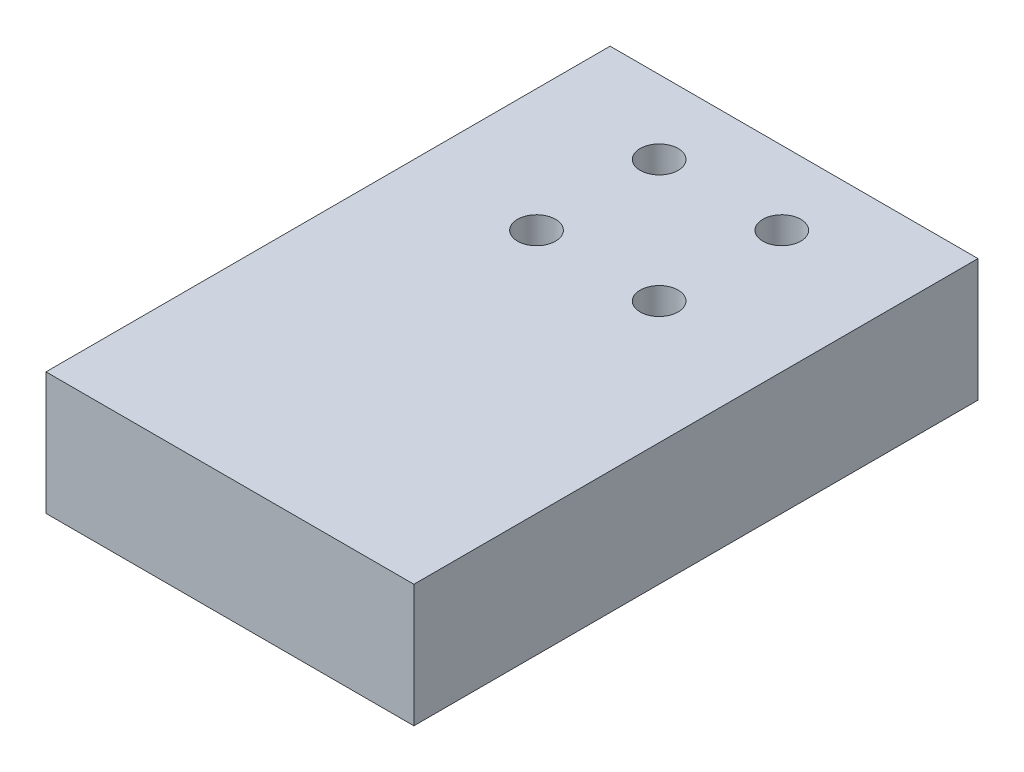
from build123d import *

# Parameters (mm, degrees)
SKETCH_1_W          = 30
SKETCH_1_H          = 30
EXTRUDE_1_DEPTH     = 10
SKETCH_4_R          = 1.55
CUT_EXTRUDE_1_DEPTH = 30
SKETCH_5_R          = 3.5
SKETCH_5_R_2        = 1.55
CUT_EXTRUDE_2_DEPTH = 3
SKETCH_6_W          = 30
SKETCH_6_H          = 10
EXTRUDE_2_DEPTH     = 16


with BuildPart() as part:
    # 草图1 → 凸台-拉伸1 (new body)
    with BuildSketch(Plane(origin=(0, 0, 0), x_dir=(1, 0, 0), z_dir=(0, 1, 0))):
        Rectangle(SKETCH_1_W, SKETCH_1_H)
    extrude(amount=EXTRUDE_1_DEPTH)

    # 草图4 → 切除-拉伸1 (cut)
    with BuildSketch(Plane.XZ):
        with Locations(Location((5, 1, 0), (0, 0, 270))):
            Circle(SKETCH_4_R)
        with Locations(Location((5, -9, 0), (0, 0, 270))):
            Circle(SKETCH_4_R)
        with Locations(Location((-5, 1, 0), (0, 0, 270))):
            Circle(SKETCH_4_R)
        with Locations(Location((-5, -9, 0), (0, 0, 270))):
            Circle(SKETCH_4_R)
    extrude(amount=-CUT_EXTRUDE_1_DEPTH, mode=Mode.SUBTRACT)

    # 草图5 → 切除-拉伸2 (cut)
    # profile 1 of 4: a face of its own
    with BuildSketch(Plane.XZ):
        with Locations(Location((5, 1, 0), (0, 0, 270))):
            Circle(SKETCH_5_R)
        with Locations(Location((5, 1, 0), (0, 0, 270))):
            Circle(SKETCH_5_R_2, mode=Mode.SUBTRACT)
    # profile 2 of 4: a face of its own
    with BuildSketch(Plane.XZ):
        with Locations(Location((5, -9, 0), (0, 0, 270))):
            Circle(SKETCH_5_R)
        with Locations(Location((5, -9, 0), (0, 0, 270))):
            Circle(SKETCH_5_R_2, mode=Mode.SUBTRACT)
    # profile 3 of 4: a face of its own
    with BuildSketch(Plane.XZ):
        with Locations(Location((-5, -9, 0), (0, 0, 270))):
            Circle(SKETCH_5_R)
        with Locations(Location((-5, -9, 0), (0, 0, 270))):
            Circle(SKETCH_5_R_2, mode=Mode.SUBTRACT)
    # profile 4 of 4: a face of its own
    with BuildSketch(Plane.XZ):
        with Locations(Location((-5, 1, 0), (0, 0, 270))):
            Circle(SKETCH_5_R)
    extrude(amount=-CUT_EXTRUDE_2_DEPTH, mode=Mode.SUBTRACT)

    # 草图6 → 凸台-拉伸2 (add)
    with BuildSketch(Plane.XY.offset(15)):
        with Locations((0, 5)):
            Rectangle(SKETCH_6_W, SKETCH_6_H)
    extrude(amount=EXTRUDE_2_DEPTH)


solid = part.part
